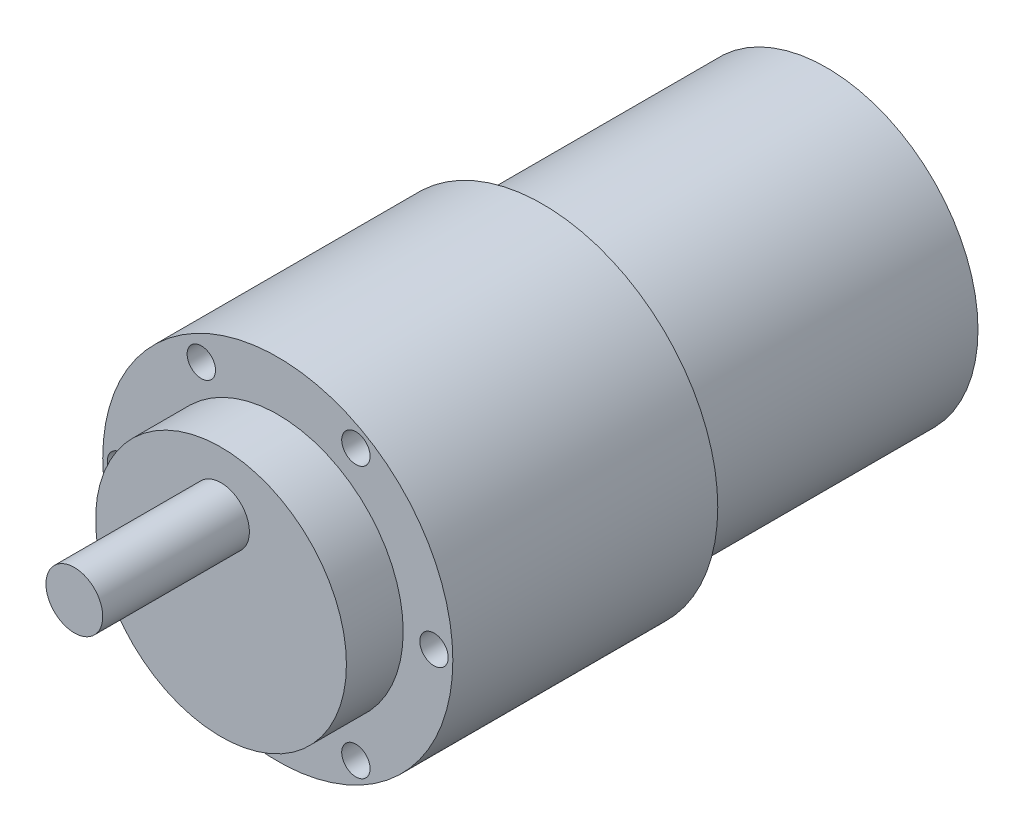
from build123d import *

# Parameters (mm, degrees)
SKETCH1_R                    = 16
BOSS_EXTRUDE1_DEPTH          = 30
SKETCH2_R                    = 18.5
BOSS_EXTRUDE2_DEPTH          = 28
SKETCH3_R                    = 13.255383993
BOSS_EXTRUDE3_DEPTH          = 6
SKETCH4_R                    = 3
BOSS_EXTRUDE4_DEPTH          = 15.5
F_3_0_3_DIAMETER_HOLE2_D     = 3
F_3_0_3_DIAMETER_HOLE2_DEPTH = 3.556
F_3_0_3_DIAMETER_HOLE2_TIP   = 0.901290929
F_3_0_3_DIAMETER_HOLE1_D     = 3
F_3_0_3_DIAMETER_HOLE1_DEPTH = 3.499993
F_3_0_3_DIAMETER_HOLE1_TIP   = 0.901290929


with BuildPart() as part:
    # Sketch1 → Boss-Extrude1 (new body)
    with BuildSketch(Plane.XY):
        Circle(SKETCH1_R)
    extrude(amount=BOSS_EXTRUDE1_DEPTH)

    # Sketch2 → Boss-Extrude2 (add)
    with BuildSketch(Plane.XY.offset(30)):
        Circle(SKETCH2_R)
    extrude(amount=BOSS_EXTRUDE2_DEPTH)

    # Sketch3 → Boss-Extrude3 (add)
    with BuildSketch(Plane.XY.offset(58)):
        Circle(SKETCH3_R)
    extrude(amount=BOSS_EXTRUDE3_DEPTH)

    # Sketch4 → Boss-Extrude4 (add)
    with BuildSketch(Plane.XY.offset(64)):
        with Locations((0, 7)):
            Circle(SKETCH4_R)
    extrude(amount=BOSS_EXTRUDE4_DEPTH)

    # Ø3.0 (3) Diameter Hole2
    with Locations(Plane.XY.offset(58)):
        with Locations((-8.079199421, 13.993583881), (-16.51, 0), (8.255, -14.298079416), (-8.255, -14.298079416), (8.255, 14.298079416), (16.51, 0)):
            Hole(F_3_0_3_DIAMETER_HOLE2_D / 2, depth=F_3_0_3_DIAMETER_HOLE2_DEPTH)
            with Locations((0, 0, -(F_3_0_3_DIAMETER_HOLE2_DEPTH + F_3_0_3_DIAMETER_HOLE2_TIP / 2))):  # 118° drill point
                Cone(0, F_3_0_3_DIAMETER_HOLE2_D / 2, F_3_0_3_DIAMETER_HOLE2_TIP, mode=Mode.SUBTRACT)

    # Ø3.0 (3) Diameter Hole1
    with Locations(Plane.XY.offset(58)):
        with Locations((-16.51, 0), (8.255, -14.298079416), (16.51, 0), (8.255, 14.298079416)):
            Hole(F_3_0_3_DIAMETER_HOLE1_D / 2, depth=F_3_0_3_DIAMETER_HOLE1_DEPTH)
            with Locations((0, 0, -(F_3_0_3_DIAMETER_HOLE1_DEPTH + F_3_0_3_DIAMETER_HOLE1_TIP / 2))):  # 118° drill point
                Cone(0, F_3_0_3_DIAMETER_HOLE1_D / 2, F_3_0_3_DIAMETER_HOLE1_TIP, mode=Mode.SUBTRACT)


solid = part.part
